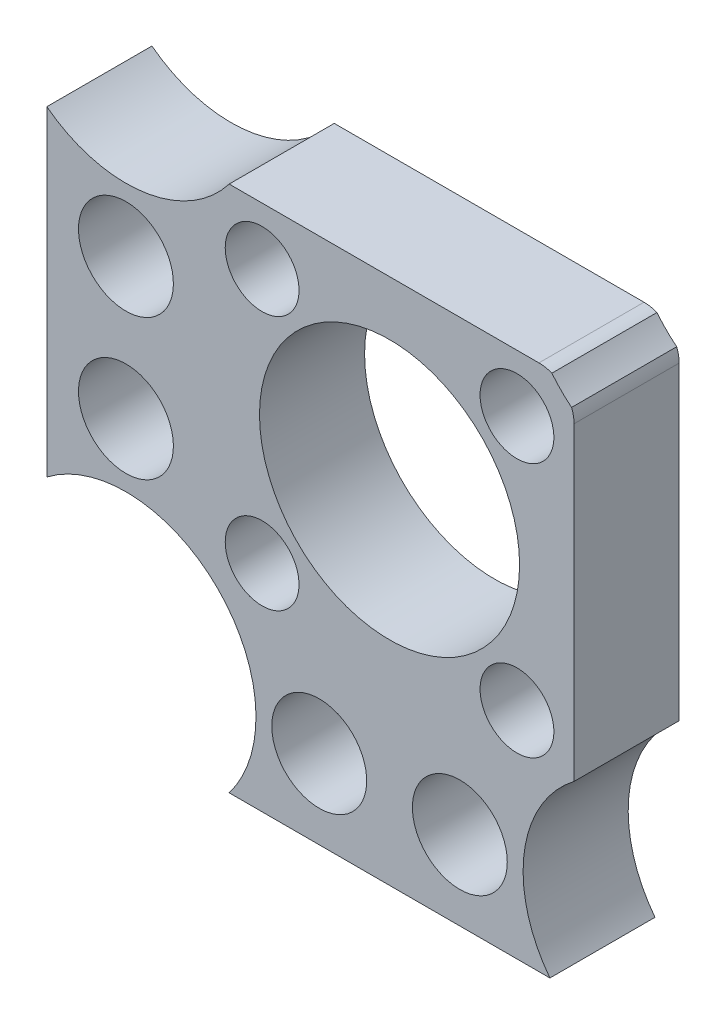
from build123d import *

# Parameters (mm, degrees)
SKETCH1_R                   = 7.4
BOSS_EXTRUDE1_DEPTH         = 5.98
CUT_EXTRUDE1_REACH          = 30.218
SKETCH2_R                   = 2.1
CIRPATTERN1_COUNT           = 4
FILLET1_R                   = 7
CUT_EXTRUDE2_DEPTH          = 11
FILLET2_R                   = 2
CIRPATTERN2_COUNT           = 4
CUT_EXTRUDE3_REACH          = 30.218
SKETCH4_R                   = 2.7
CIRPATTERN3_COUNT           = 2
CIRPATTERN3_ANGLE           = 90
CIRPATTERN3_COPY_1_REACH    = 30.218
CIRPATTERN3_COPY_1_SKETCH_R = 2.7


with BuildPart() as part:
    # Sketch1 → Boss-Extrude1 (new body)
    with BuildSketch(Plane.XY):
        Polygon((-10.5, -10.5), (-10.5, -19.5), (10.5, -19.5), (10.5, 10.5), (-19.5, 10.5), (-19.5, -10.5), align=None)
        Circle(SKETCH1_R, mode=Mode.SUBTRACT)
    extrude(amount=-BOSS_EXTRUDE1_DEPTH)

    # Sketch2 → Cut-Extrude1 (cut, up to next)
    with BuildSketch(Plane(origin=(0, 0, -5.98), x_dir=(-1, 0, 0), z_dir=(0, 0, -1)), mode=Mode.PRIVATE) as cut_extrude1_sk1:
        with Locations((-7.25, 7.25)):
            Circle(SKETCH2_R)
    cut_extrude1_tool1 = extrude(cut_extrude1_sk1.sketch, amount=-CUT_EXTRUDE1_REACH, mode=Mode.PRIVATE) & part.part
    cut_extrude1 = cut_extrude1_tool1.solids().sort_by_distance((7.25, 7.25, -5.98))[0]
    add(cut_extrude1, mode=Mode.SUBTRACT)

    # CirPattern1: Cut-Extrude1 ×4 about axis
    cirpattern1_axis = Axis((0, 0, 0), (0, 0, 1))
    for i in range(1, CIRPATTERN1_COUNT):
        add(cut_extrude1.rotate(cirpattern1_axis, i * 360 / CIRPATTERN1_COUNT), mode=Mode.SUBTRACT)

    # Fillet1
    fillet1_edges = [part.edges().sort_by_distance(p)[0] for p in [
        (-10.5, -10.5, -2.99),
    ]]
    fillet(fillet1_edges, radius=FILLET1_R)

    # Sketch3 → Cut-Extrude2 (cut)
    with BuildSketch(Plane(origin=(0, 0, -5.98), x_dir=(-1, 0, 0), z_dir=(0, 0, -1))):
        with BuildLine():
            ThreePointArc((19.5, -9.125478743), (14.512977444, -7.616043809), (9.767409819, -9.767409819))
            Line((9.767409819, -9.767409819), (12.550252532, -12.550252532))
            ThreePointArc((12.550252532, -12.550252532), (14.821215973, -11.032843272), (17.5, -10.5))
            Line((17.5, -10.5), (19.5, -10.5))
            Line((19.5, -10.5), (19.5, -9.125478743))
        make_face()
        with BuildLine():
            ThreePointArc((17.5, -10.5), (14.821215973, -11.032843272), (12.550252532, -12.550252532))
            Line((12.550252532, -12.550252532), (20.232590181, -20.232590181))
            ThreePointArc((20.232590181, -20.232590181), (21.836708541, -17.8318574), (22.4, -15))
            ThreePointArc((22.4, -15), (21.63551053, -11.724332129), (19.5, -9.125478743))
            Line((19.5, -9.125478743), (19.5, -10.5))
            Line((19.5, -10.5), (17.5, -10.5))
        make_face()
        with BuildLine():
            Line((12.550252532, -12.550252532), (9.767409819, -9.767409819))
            ThreePointArc((9.767409819, -9.767409819), (7.616043809, -14.512977444), (9.125478743, -19.5))
            Line((9.125478743, -19.5), (10.5, -19.5))
            Line((10.5, -19.5), (10.5, -17.5))
            ThreePointArc((10.5, -17.5), (11.032843272, -14.821215973), (12.550252532, -12.550252532))
        make_face()
        with BuildLine():
            Line((20.232590181, -20.232590181), (12.550252532, -12.550252532))
            ThreePointArc((12.550252532, -12.550252532), (11.032843272, -14.821215973), (10.5, -17.5))
            Line((10.5, -17.5), (10.5, -19.5))
            Line((10.5, -19.5), (9.125478743, -19.5))
            ThreePointArc((9.125478743, -19.5), (14.512977444, -22.383956191), (20.232590181, -20.232590181))
        make_face()
    cut_extrude2 = extrude(amount=-CUT_EXTRUDE2_DEPTH, mode=Mode.SUBTRACT)

    # Fillet2
    fillet2_edges = [part.edges().sort_by_distance(p)[0] for p in [
        (10.5, 10.5, -2.99),
    ]]
    fillet(fillet2_edges, radius=FILLET2_R)

    # CirPattern2: Cut-Extrude2 ×4 about axis
    cirpattern2_axis = Axis((0, 0, 0), (0, 0, 1))
    for i in range(1, CIRPATTERN2_COUNT):
        add(cut_extrude2.rotate(cirpattern2_axis, i * 360 / CIRPATTERN2_COUNT), mode=Mode.SUBTRACT)

    # Sketch4 → Cut-Extrude3 (cut, up to next)
    with BuildSketch(Plane.XY, mode=Mode.PRIVATE) as cut_extrude3_sk1:
        with Locations((4, -15)):
            Circle(SKETCH4_R)
    cut_extrude3_tool1 = extrude(cut_extrude3_sk1.sketch, amount=-CUT_EXTRUDE3_REACH, mode=Mode.PRIVATE) & part.part
    cut_extrude3 = cut_extrude3_tool1.solids().sort_by_distance((4, -15, 0))[0]
    add(cut_extrude3, mode=Mode.SUBTRACT)

    # Mirror1: Cut-Extrude3 across plane
    add(cut_extrude3.mirror(Plane(origin=(0, 0, 0), x_dir=(0, 0, 1), z_dir=(1, 0, 0))), mode=Mode.SUBTRACT)

    # CirPattern3: Cut-Extrude3 ×2 about axis
    cirpattern3_axis = Axis((0, 0, -48.426406871), (0, 0, -1))
    for i in range(1, CIRPATTERN3_COUNT):
        add(cut_extrude3.rotate(cirpattern3_axis, i * CIRPATTERN3_ANGLE / (CIRPATTERN3_COUNT - 1)), mode=Mode.SUBTRACT)

    # CirPattern3 copy 1 sketch → CirPattern3 copy 1 (cut, up to next)
    with BuildSketch(Plane(origin=(0, 0, 0), x_dir=(0, 1, 0), z_dir=(0, 0, 1)), mode=Mode.PRIVATE) as cirpattern3_copy_1_sk1:
        with Locations((4, 15)):
            Circle(CIRPATTERN3_COPY_1_SKETCH_R)
    cirpattern3_copy_1_tool1 = extrude(cirpattern3_copy_1_sk1.sketch, amount=-CIRPATTERN3_COPY_1_REACH, mode=Mode.PRIVATE) & part.part
    add(cirpattern3_copy_1_tool1.solids().sort_by_distance((-15, 4, 0))[0], mode=Mode.SUBTRACT)


solid = part.part
